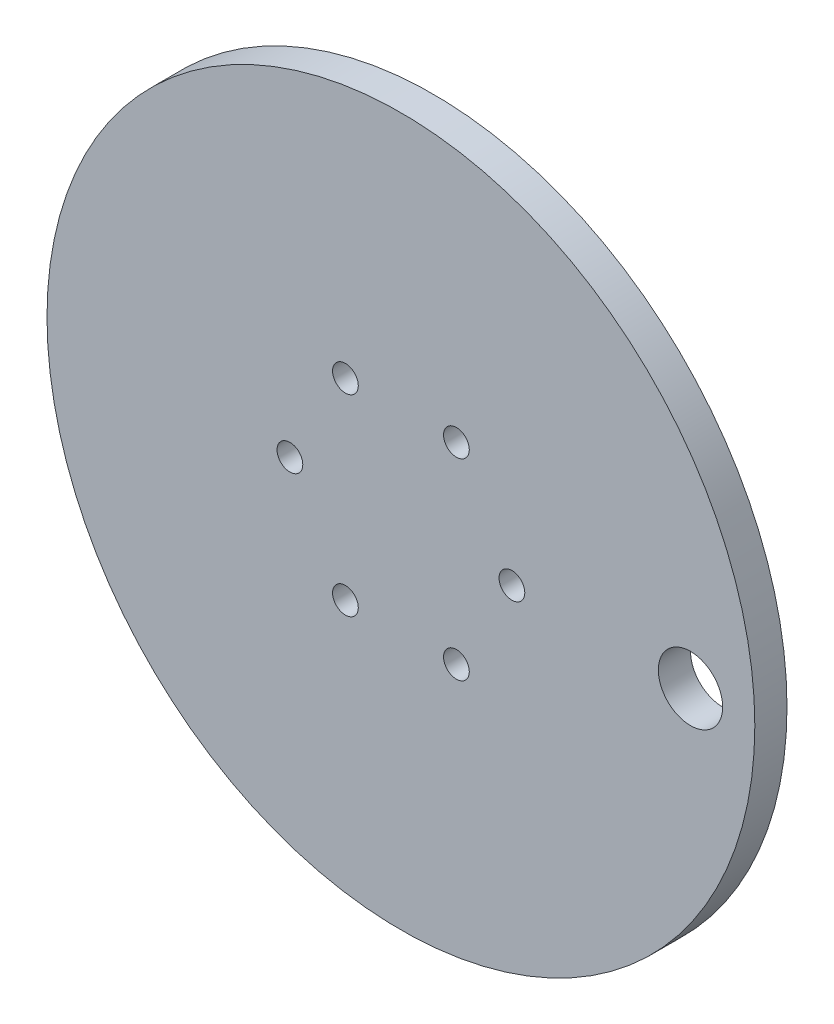
from build123d import *

# Parameters (mm, degrees)
SKETCH_1_R          = 22.5
EXTRUDE_1_DEPTH     = 5
SKETCH_2_R          = 2
CUT_EXTRUDE_1_DEPTH = 33.210246817
SKETCH_3_R          = 55
EXTRUDE_2_DEPTH     = 5
SKETCH_4_R          = 5
CUT_EXTRUDE_2_DEPTH = 79.421935707
SKETCH_5_R          = 2
CUT_EXTRUDE_3_DEPTH = 78.942286341


with BuildPart() as part:
    # 草图1 → 凸台-拉伸1 (new body)
    with BuildSketch(Plane.XY):
        Circle(SKETCH_1_R)
    extrude(amount=EXTRUDE_1_DEPTH)

    # 草图2 → 切除-拉伸1 (cut, through all)
    with BuildSketch(Plane.XY.offset(5)):
        with Locations((17.25, 0)):
            Circle(SKETCH_2_R)
        with Locations((8.625, -14.938938215)):
            Circle(SKETCH_2_R)
        with Locations((-8.625, -14.938938215)):
            Circle(SKETCH_2_R)
        with Locations((-17.25, 0)):
            Circle(SKETCH_2_R)
        with Locations((-8.625, 14.938938215)):
            Circle(SKETCH_2_R)
        with Locations((8.625, 14.938938215)):
            Circle(SKETCH_2_R)
    extrude(amount=-CUT_EXTRUDE_1_DEPTH, mode=Mode.SUBTRACT)

    # 草图3 → 凸台-拉伸2 (add)
    with BuildSketch(Plane.XY.offset(5)):
        Circle(SKETCH_3_R)
    extrude(amount=EXTRUDE_2_DEPTH)

    # 草图4 → 切除-拉伸2 (cut, through all)
    with BuildSketch(Plane.XY.offset(10)):
        with Locations((45, 0)):
            Circle(SKETCH_4_R)
    extrude(amount=-CUT_EXTRUDE_2_DEPTH, mode=Mode.SUBTRACT)

    # 草图5 → 切除-拉伸3 (cut, through all)
    with BuildSketch(Plane(origin=(0, 0, 5), x_dir=(-1, 0, 0), z_dir=(0, 0, -1))):
        with Locations(Location((-8.625, 14.938938215, 0), (0, 0, 180))):
            Circle(SKETCH_5_R)
        with Locations(Location((-17.25, 0, 0), (0, 0, 180))):
            Circle(SKETCH_5_R)
        with Locations(Location((-8.625, -14.938938215, 0), (0, 0, 180))):
            Circle(SKETCH_5_R)
        with Locations(Location((8.625, -14.938938215, 0), (0, 0, 180))):
            Circle(SKETCH_5_R)
        with Locations(Location((17.25, 0, 0), (0, 0, 180))):
            Circle(SKETCH_5_R)
        with Locations(Location((8.625, 14.938938215, 0), (0, 0, 180))):
            Circle(SKETCH_5_R)
    extrude(amount=-CUT_EXTRUDE_3_DEPTH, mode=Mode.SUBTRACT)


solid = part.part
